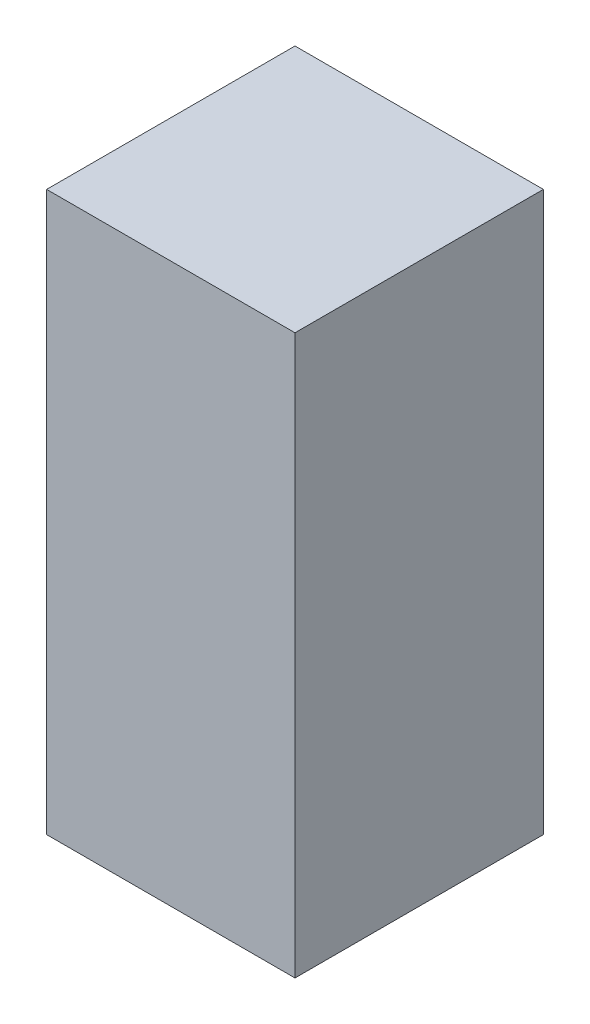
from build123d import *

# Parameters (mm, degrees)
PACK_KOSE_PLOWU_2_1_START = -552.5
SKETCH1_W                 = 20
SKETCH1_H                 = 45
PACK_KOSE_PLOWU_2_1_DEPTH = 20


with BuildPart() as part:
    # Sketch1 → PACK_kose_plowu_2_1 (new body)
    with BuildSketch(Plane.XY.offset(PACK_KOSE_PLOWU_2_1_START)):
        with Locations((512.5, 574.5)):
            Rectangle(SKETCH1_W, SKETCH1_H)
    extrude(amount=-PACK_KOSE_PLOWU_2_1_DEPTH)


solid = part.part
